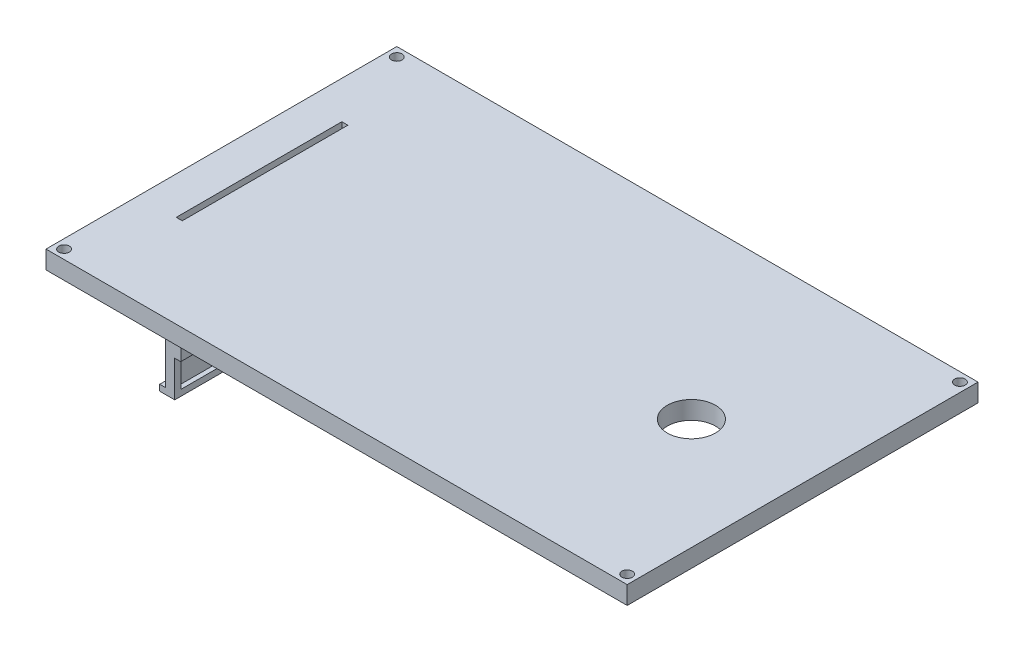
from build123d import *

# Parameters (mm, degrees)
SKETCH1_W            = 193
SKETCH1_H            = 116.5
SKETCH1_R            = 1.75
SKETCH1_R_2          = 8
SKETCH1_W_2          = 2
SKETCH1_H_2          = 55
BOSS_EXTRUDE1_DEPTH  = 6
SKETCH3_W            = 10
SKETCH3_H            = 10
BOSS_EXTRUDE3_DEPTH  = 10
SKETCH5_W            = 2
SKETCH5_H            = 55
BOSS_EXTRUDE4_DEPTH  = 6
SKETCH6_W            = 181
SKETCH6_H            = 104.5
CUT_EXTRUDE1_DEPTH   = 4
SKETCH7_W            = 1.5
SKETCH7_H            = 55
BOSS_EXTRUDE5_DEPTH  = 44.75
SKETCH8_W            = 2
SKETCH8_H            = 55
CUT_EXTRUDE2_DEPTH   = 42.25
FILLET3_R            = 3
SKETCH12_W           = 55
SKETCH12_H           = 2
BOSS_EXTRUDE6_DEPTH  = 1.5
SKETCH14_W           = 3
SKETCH14_H           = 44.75
BOSS_EXTRUDE7_DEPTH  = 2
SKETCH15_W           = 3
SKETCH15_H           = 44.75
BOSS_EXTRUDE8_DEPTH  = 2
BOSS_EXTRUDE9_DEPTH  = 2
SKETCH18_W           = 20
SKETCH18_H           = 32.75
BOSS_EXTRUDE10_DEPTH = 2


with BuildPart() as part:
    # Sketch1 → Boss-Extrude1 (new body)
    with BuildSketch(Plane(origin=(0, 0, 0), x_dir=(1, 0, 0), z_dir=(0, 1, 0))):
        with Locations((22.87983871, -17.078434096)):
            Rectangle(SKETCH1_W, SKETCH1_H)
        with Locations(Location((-70.62016129, -72.328434096, 0), (0, 0, 270))):
            Circle(SKETCH1_R, mode=Mode.SUBTRACT)
        with Locations(Location((-70.62016129, 38.171565904, 0), (0, 0, 270))):
            Circle(SKETCH1_R, mode=Mode.SUBTRACT)
        with Locations(Location((116.37983871, -72.328434096, 0), (0, 0, 270))):
            Circle(SKETCH1_R, mode=Mode.SUBTRACT)
        with Locations(Location((116.37983871, 38.171565904, 0), (0, 0, 270))):
            Circle(SKETCH1_R, mode=Mode.SUBTRACT)
        with Locations(Location((82.450678359, -17.078434096, 0), (0, 0, 270))):
            Circle(SKETCH1_R_2, mode=Mode.SUBTRACT)
        with Locations((-47.331266899, -17.078434096)):
            Rectangle(SKETCH1_W_2, SKETCH1_H_2, mode=Mode.SUBTRACT)
    extrude(amount=BOSS_EXTRUDE1_DEPTH)

    # Sketch3 → Boss-Extrude3 (add)
    with BuildSketch(Plane.XZ):
        with Locations((-62.62016129, 64.328434096)):
            Rectangle(SKETCH3_W, SKETCH3_H)
        with Locations((-62.62016129, -30.171565904)):
            Rectangle(SKETCH3_W, SKETCH3_H)
        with Locations((108.37983871, -30.171565904)):
            Rectangle(SKETCH3_W, SKETCH3_H)
        with Locations((108.37983871, 64.328434096)):
            Rectangle(SKETCH3_W, SKETCH3_H)
    extrude(amount=BOSS_EXTRUDE3_DEPTH)

    # Sketch5 → Boss-Extrude4 (add)
    with BuildSketch(Plane.XZ):
        with Locations((-47.331266899, 17.078434096)):
            Rectangle(SKETCH5_W, SKETCH5_H)
    extrude(amount=-BOSS_EXTRUDE4_DEPTH)

    # Sketch6 → Cut-Extrude1 (cut)
    with BuildSketch(Plane.XZ.offset(10)):
        with Locations((22.87983871, 17.078434096)):
            Rectangle(SKETCH6_W, SKETCH6_H)
    extrude(amount=-CUT_EXTRUDE1_DEPTH, mode=Mode.SUBTRACT)

    # Sketch7 → Boss-Extrude5 (add)
    with BuildSketch(Plane.XZ):
        with Locations((-61.87016129, 17.078434096)):
            Rectangle(SKETCH7_W, SKETCH7_H)
    extrude(amount=BOSS_EXTRUDE5_DEPTH)

    # Sketch8 → Cut-Extrude2 (cut)
    with BuildSketch(Plane.XZ):
        with Locations((-60.12016129, 17.078434096)):
            Rectangle(SKETCH8_W, SKETCH8_H)
    extrude(amount=-CUT_EXTRUDE2_DEPTH, mode=Mode.SUBTRACT)

    # Fillet3
    fillet3_edges = [part.edges().sort_by_distance(p)[0] for p in [
        (-67.62016129, -6, 64.328434096),
        (-67.62016129, -6, -30.171565904),
        (-62.62016129, -6, -35.171565904),
        (108.37983871, -6, -35.171565904),
        (-62.62016129, -6, 69.328434096),
        (108.37983871, -6, 69.328434096),
        (113.37983871, -6, -30.171565904),
        (113.37983871, -6, 64.328434096),
        (-62.62016129, -6, 59.328434096),
        (-57.62016129, -6, 64.328434096),
        (103.37983871, -6, 64.328434096),
        (108.37983871, -6, 59.328434096),
        (108.37983871, -6, -25.171565904),
        (103.37983871, -6, -30.171565904),
        (-57.62016129, -6, -30.171565904),
        (-62.62016129, -6, -25.171565904),
    ]]
    fillet(fillet3_edges, radius=FILLET3_R)

    # Sketch12 → Boss-Extrude6 (add)
    with BuildSketch(Plane(origin=(-61.12016129, 0, 0), x_dir=(0, 0, -1), z_dir=(1, 0, 0))):
        with Locations((-17.078434096, -43.75)):
            Rectangle(SKETCH12_W, SKETCH12_H)
    extrude(amount=BOSS_EXTRUDE6_DEPTH)

    # Sketch14 → Boss-Extrude7 (add)
    with BuildSketch(Plane(origin=(0, 0, -10.421565904), x_dir=(-1, 0, 0), z_dir=(0, 0, -1))):
        with Locations((61.12016129, -22.375)):
            Rectangle(SKETCH14_W, SKETCH14_H)
    extrude(amount=BOSS_EXTRUDE7_DEPTH)

    # Sketch15 → Boss-Extrude8 (add)
    with BuildSketch(Plane.XY.offset(44.578434096)):
        with Locations((-61.12016129, -22.375)):
            Rectangle(SKETCH15_W, SKETCH15_H)
    extrude(amount=BOSS_EXTRUDE8_DEPTH)

    # Sketch16 → Boss-Extrude9 (add)
    with BuildSketch(Plane.ZY.offset(62.62016129)):
        Polygon((-10.421565904, 0), (-10.421565904, -42.75), (46.578434096, -42.75), (46.578434096, -44.75), (-12.421565904, -44.75), (-12.421565904, 0), align=None)
    extrude(amount=BOSS_EXTRUDE9_DEPTH)

    # Sketch18 → Boss-Extrude10 (add)
    with BuildSketch(Plane(origin=(-59.62016129, 0, 0), x_dir=(0, 0, -1), z_dir=(1, 0, 0))):
        with Locations((-36.578434096, -16.375)):
            Rectangle(SKETCH18_W, SKETCH18_H)
        with Locations((2.421565904, -16.375)):
            Rectangle(SKETCH18_W, SKETCH18_H)
    extrude(amount=BOSS_EXTRUDE10_DEPTH)


solid = part.part
